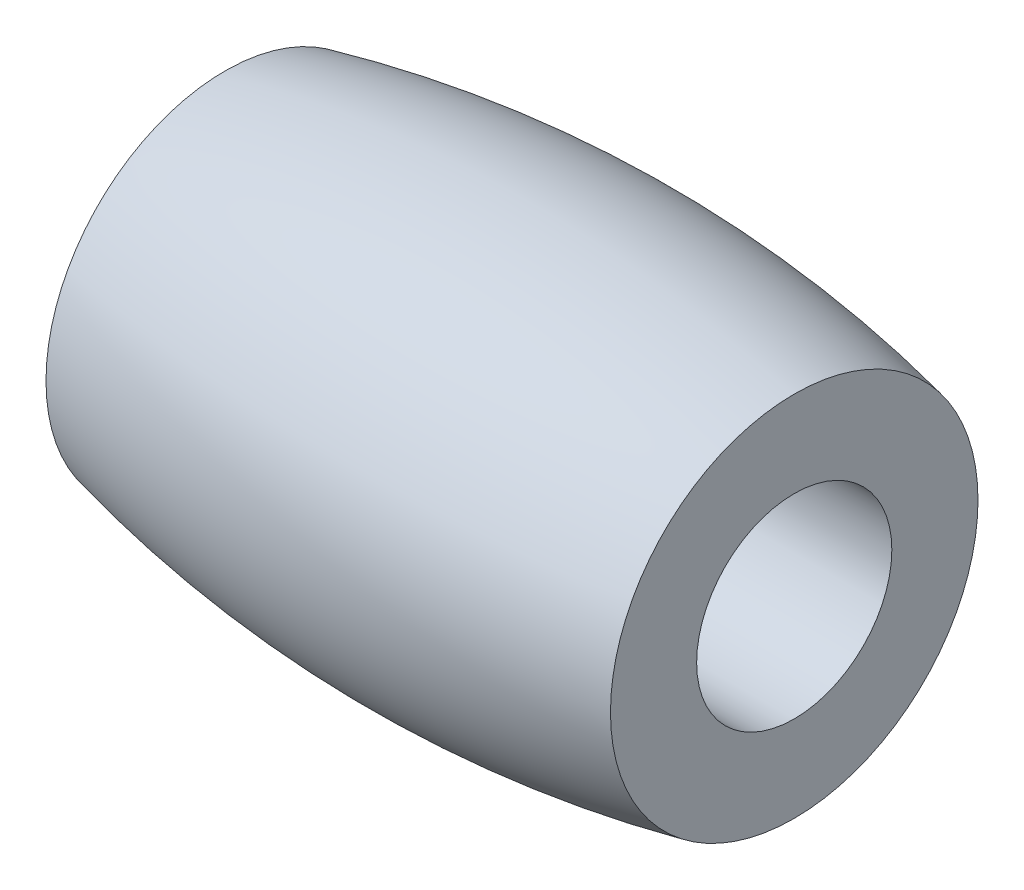
from build123d import *


with BuildPart() as part:
    # Sketch1 → Revolve1 (revolve)
    with BuildSketch(Plane.XY, mode=Mode.PRIVATE) as revolve1_sk:
        with BuildLine():
            Line((-13.20615942, 0), (9.01884058, 0))
            Line((9.01884058, 0), (9.01884058, 3.363796727))
            ThreePointArc((9.01884058, 3.363796727), (-2.104111189, 4.499772243), (-13.20615942, 3.175))
            Line((-13.20615942, 3.175), (-13.20615942, 0))
        make_face()
    revolve(revolve1_sk.sketch.rotate(Axis((-13.20615942, -3.81, 0), (1, 0, 0)), 90), axis=Axis((-13.20615942, -3.81, 0), (1, 0, 0)))


solid = part.part
